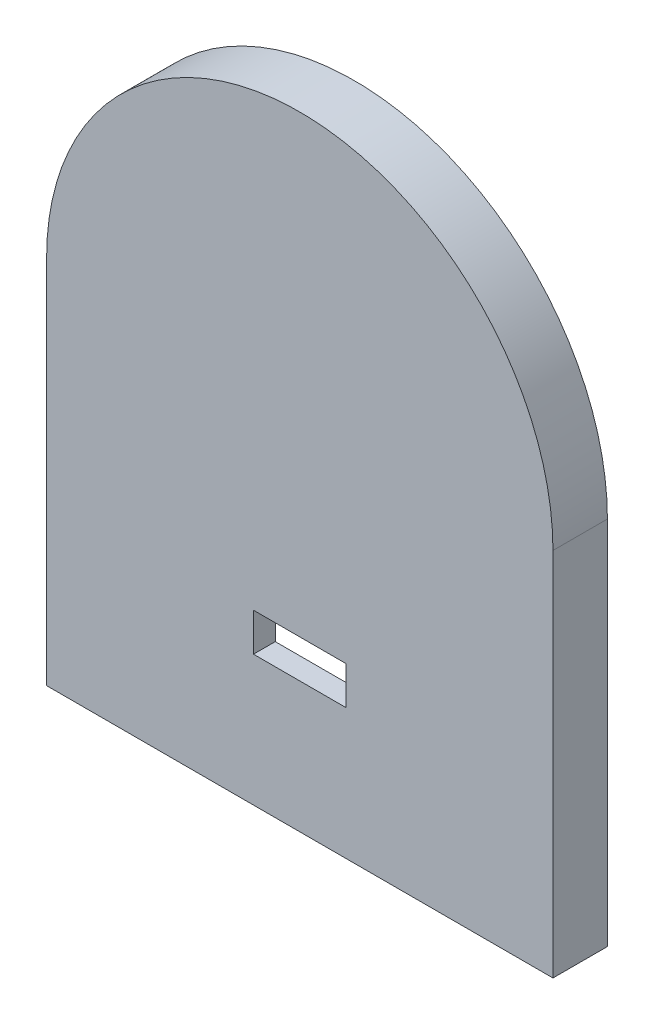
from build123d import *

# Parameters (mm, degrees)
BOSS_EXTRUDE1_DEPTH = 3
BOSS_EXTRUDE2_DEPTH = 2
BOSS_EXTRUDE3_DEPTH = 17.5
SKETCH4_W           = 8.5
SKETCH4_H           = 3.5
CUT_EXTRUDE1_DEPTH  = 74.816072098


with BuildPart() as part:
    # Sketch1 → Boss-Extrude1 (new body)
    with BuildSketch(Plane.XY):
        with BuildLine():
            Line((0, 0), (46.5, 0))
            Line((46.5, 0), (46.5, 34))
            ThreePointArc((46.5, 34), (23.25, 57.25), (0, 34))
            Line((0, 34), (0, 0))
        make_face()
        with BuildLine():
            Line((2, 2), (2, 34))
            ThreePointArc((2, 34), (23.25, 55.25), (44.5, 34))
            Line((44.5, 34), (44.5, 2))
            Line((44.5, 2), (2, 2))
        make_face(mode=Mode.SUBTRACT)
    extrude(amount=BOSS_EXTRUDE1_DEPTH)

    # Sketch2 → Boss-Extrude2 (add)
    with BuildSketch(Plane.XY.offset(3)):
        with BuildLine():
            Line((0, 34), (0, 0))
            Line((0, 0), (46.5, 0))
            Line((46.5, 0), (46.5, 34))
            ThreePointArc((46.5, 34), (23.25, 57.25), (0, 34))
        make_face()
    extrude(amount=BOSS_EXTRUDE2_DEPTH)

    # Sketch3 → Boss-Extrude3 (add)
    with BuildSketch(Plane(origin=(0, 11.2, 0), x_dir=(1, 0, 0), z_dir=(0, 1, 0))):
        Polygon((2, -2), (3.732050808, -1), (2, 0), align=None)
    boss_extrude3 = extrude(amount=BOSS_EXTRUDE3_DEPTH)

    # Mirror1: Boss-Extrude3 across plane
    add(boss_extrude3.mirror(Plane.ZY.offset(-23.25)))

    # Sketch4 → Cut-Extrude1 (cut, through all)
    with BuildSketch(Plane(origin=(0, 0, 3), x_dir=(-1, 0, 0), z_dir=(0, 0, -1))):
        with Locations((-23.25, 13.75)):
            Rectangle(SKETCH4_W, SKETCH4_H)
    extrude(amount=-CUT_EXTRUDE1_DEPTH, mode=Mode.SUBTRACT)


solid = part.part
